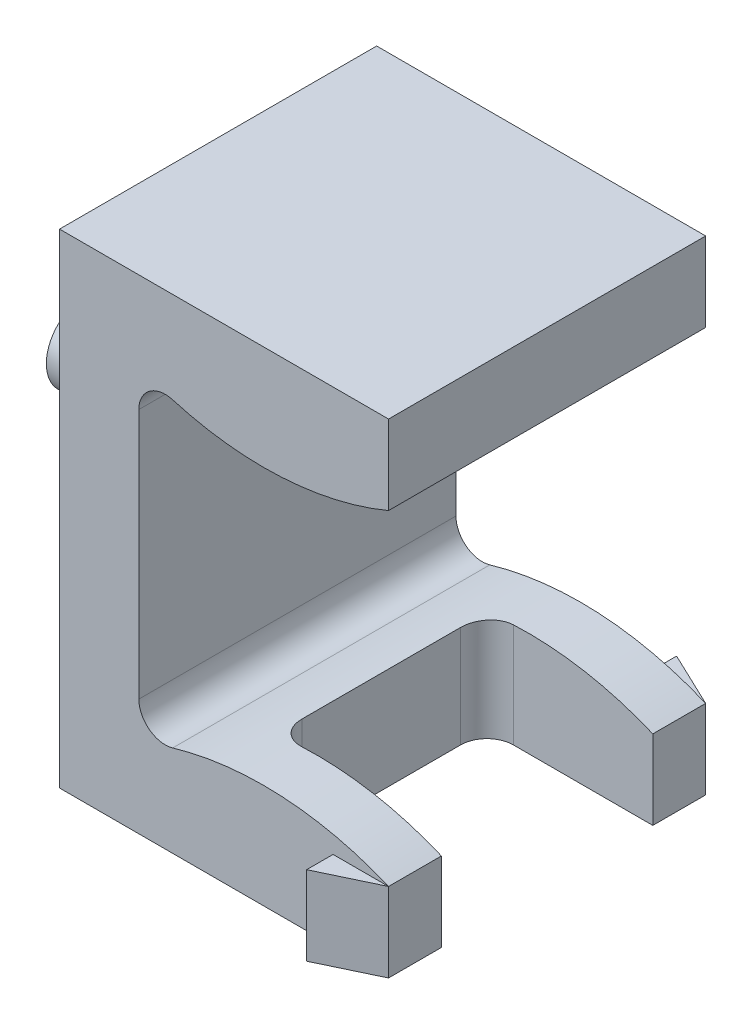
from build123d import *

# Parameters (mm, degrees)
MAINBODY_DEPTH      = 6
HOOK_DEPTH          = 3.000005
FLEX_REACH          = 175.361
FLEX_END_RADIUS     = 12.225328947
SKETCH4_W           = 6.275
SKETCH4_H           = 8
FILLET1_R           = 1
FILLET2_R           = 1
SKETCH7_R           = 1.5
BOSS_EXTRUDE2_DEPTH = 5
FILLET3_R           = 1


with BuildPart() as part:
    # Sketch1 → MainBody (new, symmetric)
    with BuildSketch(Plane.XY):
        with BuildLine():
            Line((-159.798174106, 9.159375), (-172.248174106, 9.159375))
            Line((-172.248174106, 9.159375), (-172.248174106, -9.159375))
            Line((-172.248174106, -9.159375), (-159.798174106, -9.159375))
            Line((-159.798174106, -9.159375), (-159.798174106, -6.159375))
            ThreePointArc((-159.798174106, -6.159375), (-164.523174106, -5.209375), (-169.248174106, -6.159375))
            Line((-169.248174106, -6.159375), (-169.248174106, -5.159375))
            Line((-169.248174106, -5.159375), (-169.248174106, 5.159375))
            Line((-169.248174106, 5.159375), (-169.248174106, 6.159375))
            ThreePointArc((-169.248174106, 6.159375), (-164.523174106, 5.209375), (-159.798174106, 6.159375))
            Line((-159.798174106, 6.159375), (-159.798174106, 9.159375))
        make_face()
    extrude(amount=MAINBODY_DEPTH, both=True)

    # Sketch3 → Hook (add)
    with BuildSketch(Plane.XZ.offset(9.159375)):
        Polygon((-159.798174106, -6), (-161.898174106, -7), (-161.898174106, -6), align=None)
        Polygon((-161.898174106, 6), (-159.798174106, 6), (-161.898174106, 7), align=None)
    extrude(amount=-HOOK_DEPTH)

    # Flex: up to this cylinder (the profile starts inside it)
    flex_end = Plane(origin=(-164.523174106, -17.434703947, 0), z_dir=(0, 0, -1)) * Cylinder(FLEX_END_RADIUS, 376.172657895, mode=Mode.PRIVATE)
    # Sketch4 → Flex (cut, up to the surface)
    with BuildSketch(Plane.XZ.offset(9.159375), mode=Mode.PRIVATE) as flex_sk1:
        with Locations((-162.935674106, 0)):
            Rectangle(SKETCH4_W, SKETCH4_H)
    flex_tool1 = extrude(flex_sk1.sketch, amount=-FLEX_REACH, mode=Mode.PRIVATE) & flex_end
    add(flex_tool1.solids().sort_by_distance((-162.935674, -9.159375, 0))[0], mode=Mode.SUBTRACT)

    # Fillet1
    fillet1_edges = [part.edges().sort_by_distance(p)[0] for p in [
        (-166.073174106, -7.233703596, 4),
        (-166.073174106, -7.233703596, -4),
    ]]
    fillet(fillet1_edges, radius=FILLET1_R)

    # Fillet2
    fillet2_edges = [part.edges().sort_by_distance(p)[0] for p in [
        (-169.248174106, 6.159375, 0),
        (-169.248174106, -6.159375, 0),
    ]]
    fillet(fillet2_edges, radius=FILLET2_R)

    # Sketch7 → Boss-Extrude2 (add)
    with BuildSketch(Plane.ZY.offset(172.248174106)):
        with Locations(Location((0, 0, 0), (0, 0, 180))):
            Circle(SKETCH7_R)
    extrude(amount=BOSS_EXTRUDE2_DEPTH)

    # Fillet3
    fillet3_edges = [part.edges().sort_by_distance(p)[0] for p in [
        (-172.248174106, 0, 1.5),
    ]]
    fillet(fillet3_edges, radius=FILLET3_R)


solid = part.part
